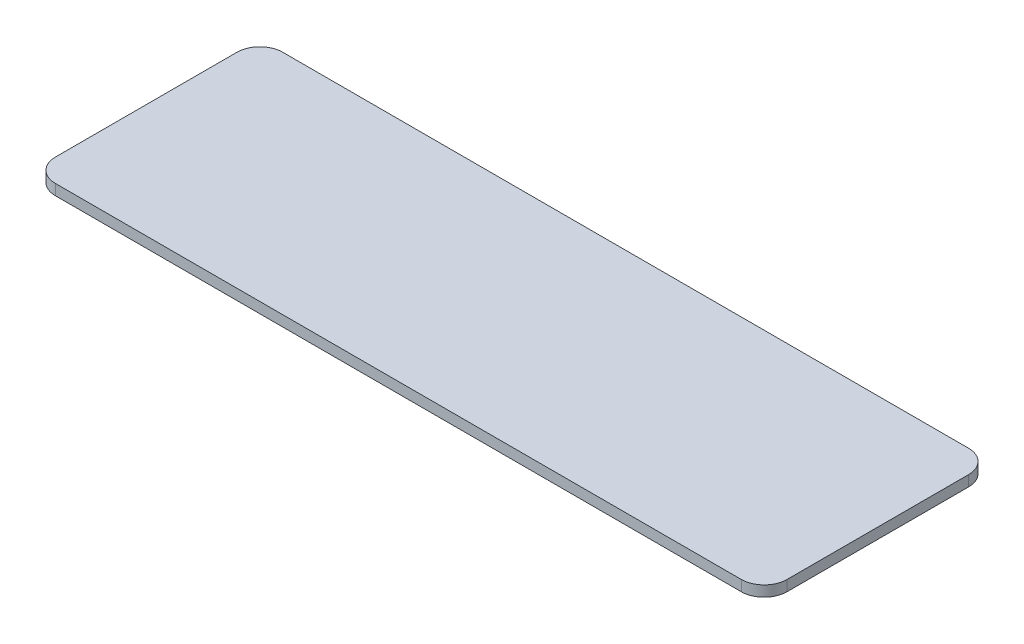
from build123d import *

# Parameters (mm, degrees)
BOSS_EXTRUDE1_DEPTH = 1.5875


with BuildPart() as part:
    # Sketch1 → Boss-Extrude1 (new body)
    with BuildSketch(Plane(origin=(0, 0, 0), x_dir=(1, 0, 0), z_dir=(0, 1, 0))):
        with BuildLine():
            Line((51, -16.9), (-51, -16.9))
            ThreePointArc((-51, -16.9), (-53.404163056, -15.904163056), (-54.4, -13.5))
            Line((-54.4, -13.5), (-54.4, 13.5))
            ThreePointArc((-54.4, 13.5), (-53.404163056, 15.904163056), (-51, 16.9))
            Line((-51, 16.9), (51, 16.9))
            ThreePointArc((51, 16.9), (53.404163056, 15.904163056), (54.4, 13.5))
            Line((54.4, 13.5), (54.4, -13.5))
            ThreePointArc((54.4, -13.5), (53.404163056, -15.904163056), (51, -16.9))
        make_face()
    extrude(amount=BOSS_EXTRUDE1_DEPTH)


solid = part.part
